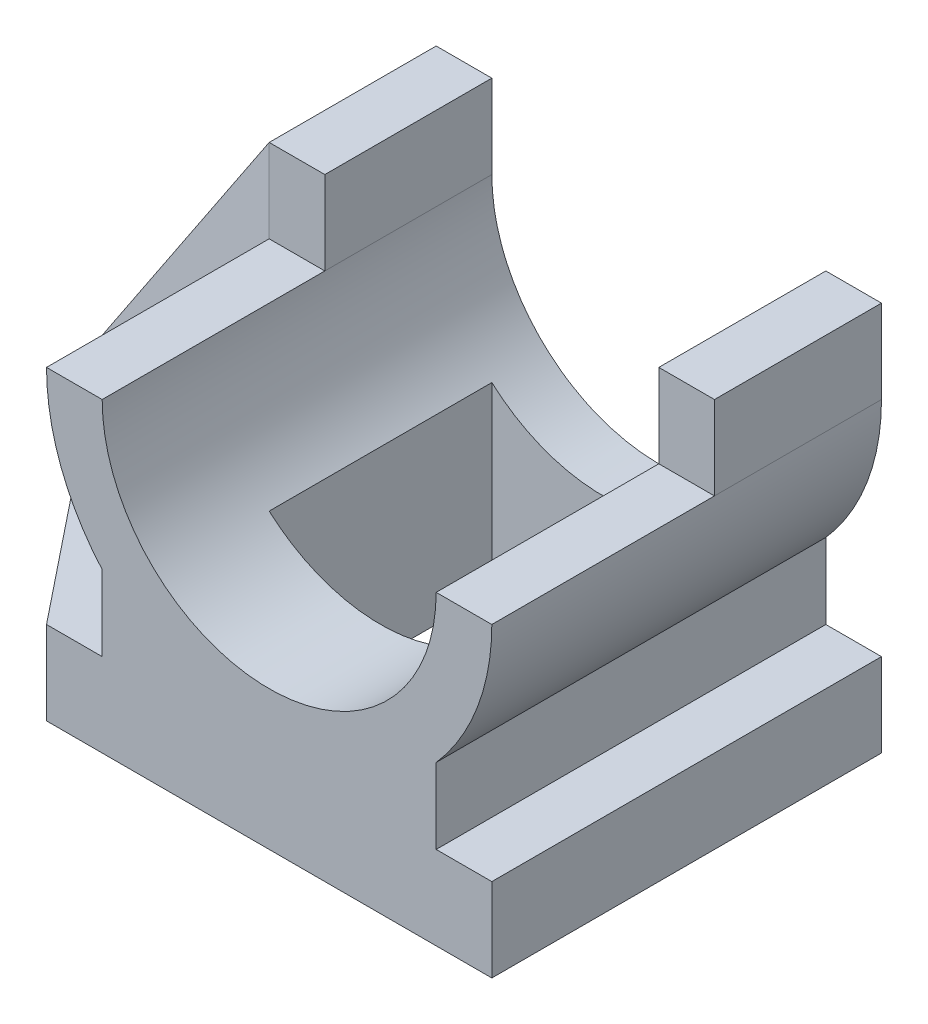
from build123d import *

# Parameters (mm, degrees)
BOSS_EXTRUDE1_DEPTH     = 15
BOSS_EXTRUDE2_DEPTH     = 70
SKETCH3_W               = 10
SKETCH3_H               = 15
BOSS_EXTRUDE3_DEPTH     = 30
CUT_EXTRUDE1_DEPTH      = 156.563491861
CUT_EXTRUDE1_DEPTH_BACK = 156.563491861
CUT_EXTRUDE2_DEPTH      = 156.563491861
CUT_EXTRUDE2_DEPTH_BACK = 156.563491861
SKETCH5_W               = 40
SKETCH5_H               = 40
BOSS_EXTRUDE4_DEPTH     = 30
CUT_EXTRUDE3_START      = 15
CUT_EXTRUDE3_DEPTH      = 60


with BuildPart() as part:
    # Sketch1 → Boss-Extrude1 (new body)
    with BuildSketch(Plane(origin=(0, 0, 0), x_dir=(1, 0, 0), z_dir=(0, 1, 0))):
        Polygon((0, 0), (0, -20), (40, -70), (120, -70), (120, 0), align=None)
    extrude(amount=BOSS_EXTRUDE1_DEPTH)

    # Sketch2 → Boss-Extrude2 (add)
    with BuildSketch(Plane.XY):
        with BuildLine():
            Line((50, 15), (110, 15))
            Line((110, 15), (110, 28.542486889))
            ThreePointArc((110, 28.542486889), (117.416573868, 40.857864376), (120, 55))
            Line((120, 55), (40, 55))
            ThreePointArc((40, 55), (42.583426132, 40.857864376), (50, 28.542486889))
            Line((50, 28.542486889), (50, 15))
        make_face()
    extrude(amount=BOSS_EXTRUDE2_DEPTH)

    # Sketch3 → Boss-Extrude3 (add)
    with BuildSketch(Plane.XY):
        with Locations((115, 62.5)):
            Rectangle(SKETCH3_W, SKETCH3_H)
    boss_extrude3 = extrude(amount=BOSS_EXTRUDE3_DEPTH)

    # Mirror1: Boss-Extrude3 across plane
    add(boss_extrude3.mirror(Plane(origin=(80, 0, 0), x_dir=(0, 0, 1), z_dir=(1, 0, 0))))

    # Sketch4 → Cut-Extrude1 (cut, two sides: drawn at the far end of the back side and taken through both)
    with BuildSketch(Plane.XY.offset(-CUT_EXTRUDE1_DEPTH_BACK)):
        with BuildLine():
            Line((50, 72), (50, 55))
            ThreePointArc((50, 55), (80, 25), (110, 55))
            Line((110, 55), (110, 72))
            Line((110, 72), (50, 72))
        make_face()
    extrude(amount=CUT_EXTRUDE1_DEPTH + CUT_EXTRUDE1_DEPTH_BACK, mode=Mode.SUBTRACT)

    # Sketch5 → Cut-Extrude2 (cut, two sides: drawn at the far end of the back side and taken through both)
    with BuildSketch(Plane(origin=(0, 0, 0), x_dir=(1, 0, 0), z_dir=(0, 1, 0)).offset(-CUT_EXTRUDE2_DEPTH_BACK)):
        with Locations((80, -30)):
            Rectangle(SKETCH5_W, SKETCH5_H)
    extrude(amount=CUT_EXTRUDE2_DEPTH + CUT_EXTRUDE2_DEPTH_BACK, mode=Mode.SUBTRACT)

    # Sketch6 → Boss-Extrude4 (add)
    with BuildSketch(Plane.XY):
        Polygon((0, 15), (40, 70), (50, 70), (50, 15), align=None)
    extrude(amount=BOSS_EXTRUDE4_DEPTH)

    # Sketch7 → Cut-Extrude3 (cut)
    with BuildSketch(Plane(origin=(0, 0, 0), x_dir=(1, 0, 0), z_dir=(0, 1, 0)).offset(CUT_EXTRUDE3_START)):
        Polygon((0, -20), (40, -30), (0, -30), align=None)
    extrude(amount=CUT_EXTRUDE3_DEPTH, mode=Mode.SUBTRACT)


solid = part.part
